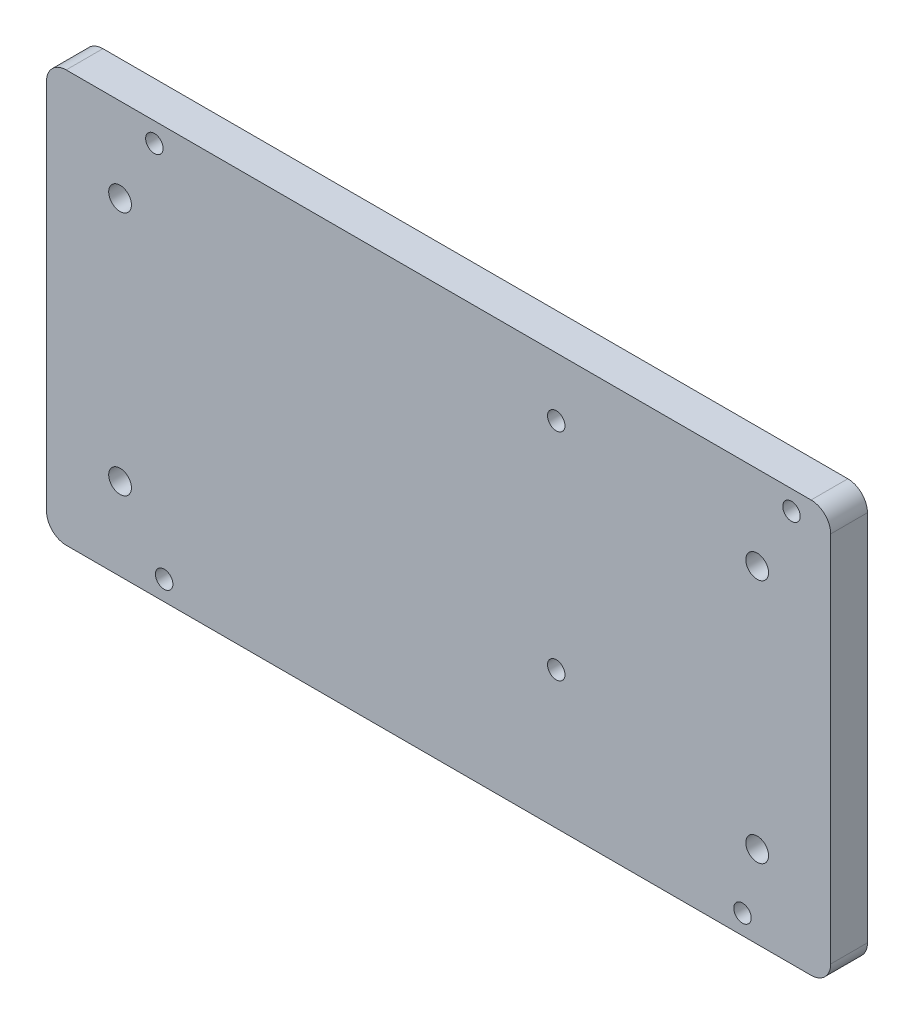
from build123d import *

# Parameters (mm, degrees)
SKETCH1_W                 = 101.6
SKETCH1_H                 = 53.34
BOSS_EXTRUDE1_DEPTH       = 4.7625
FILLET1_R                 = 2.54
TAP_DRILL_FOR_4_40_TAP1_D = 2.2606
F_4_CLEARANCE_HOLE2_D     = 2.9464


with BuildPart() as part:
    # Sketch1 → Boss-Extrude1 (new body)
    with BuildSketch(Plane.XY):
        with Locations((50.8, 26.67)):
            Rectangle(SKETCH1_W, SKETCH1_H)
    extrude(amount=BOSS_EXTRUDE1_DEPTH)

    # Fillet1
    fillet1_edges = [part.edges().sort_by_distance(p)[0] for p in [
        (0, 53.34, 2.38125),
        (101.6, 53.34, 2.38125),
        (101.6, 0, 2.38125),
        (0, 0, 2.38125),
    ]]
    fillet(fillet1_edges, radius=FILLET1_R)

    # Tap Drill for #4-40 Tap1 (through all)
    with Locations(Plane(origin=(0, 0, 0), x_dir=(-1, 0, 0), z_dir=(0, 0, -1))):
        with Locations((-15.24, 2.54), (-90.17, 2.54), (-96.52, 50.8), (-66.04, 17.78), (-66.04, 45.72), (-13.97, 50.8)):
            Hole(TAP_DRILL_FOR_4_40_TAP1_D / 2)

    # #4 Clearance Hole2 (through all)
    with Locations(Plane.XY.offset(4.7625)):
        with Locations((9.525, 42.418), (9.525, 10.668), (92.075, 42.418), (92.075, 10.668)):
            Hole(F_4_CLEARANCE_HOLE2_D / 2)


solid = part.part
